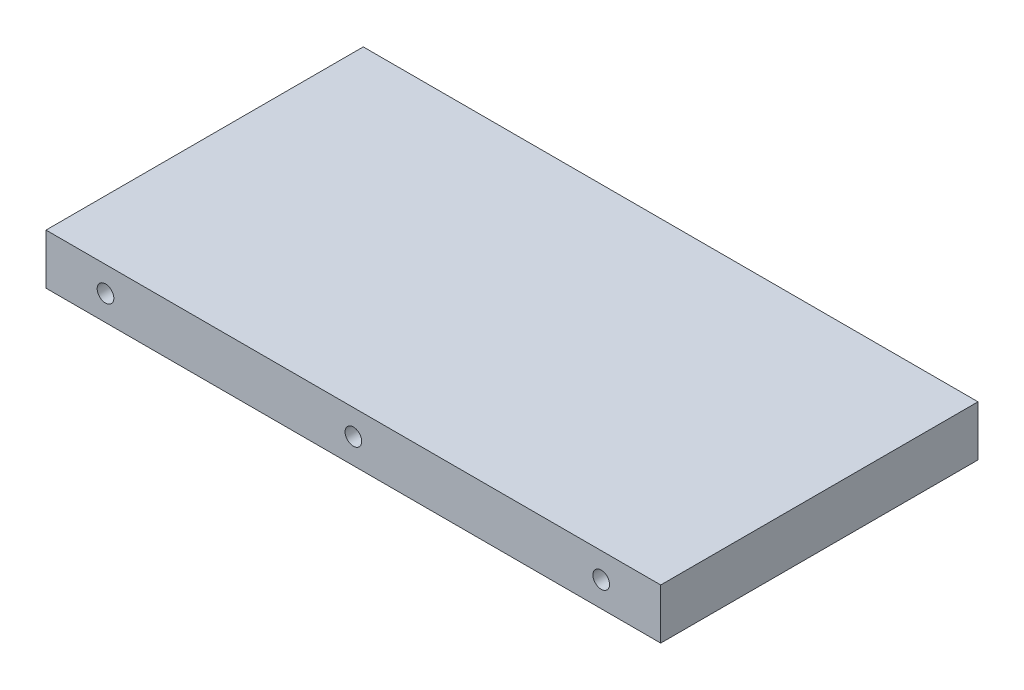
from build123d import *

# Parameters (mm, degrees)
SKETCH1_W                   = 155
SKETCH1_H                   = 80
BOSS_EXTRUDE1_DEPTH         = 12.7
TAP_DRILL_FOR_M5X0_8_TAP1_D = 4.2


with BuildPart() as part:
    # Sketch1 → Boss-Extrude1 (new body)
    with BuildSketch(Plane(origin=(0, 0, 0), x_dir=(1, 0, 0), z_dir=(0, 1, 0))):
        Rectangle(SKETCH1_W, SKETCH1_H)
    extrude(amount=BOSS_EXTRUDE1_DEPTH)

    # Tap Drill for M5x0.8 Tap1 (through all)
    with Locations(Plane.XY.offset(40)):
        with Locations((-62.5, 6.35), (0, 6.35), (62.5, 6.35)):
            Hole(TAP_DRILL_FOR_M5X0_8_TAP1_D / 2)


solid = part.part
